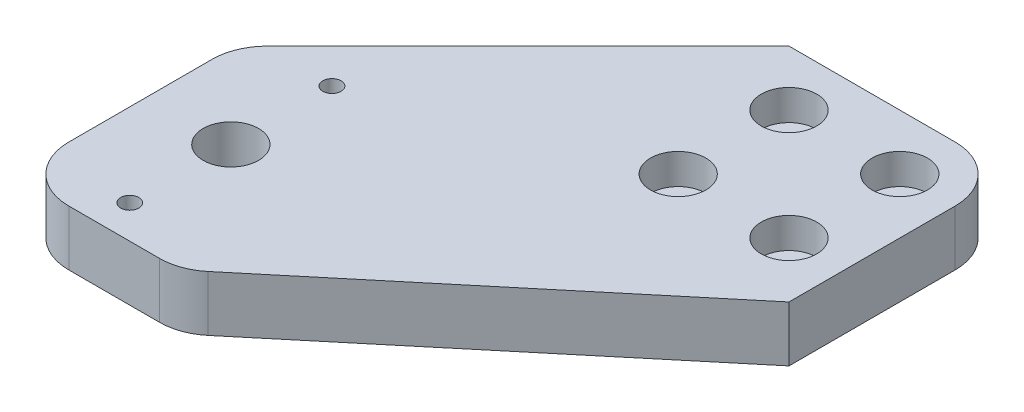
from build123d import *

# Parameters (mm, degrees)
BOSS_EXTRUDE1_DEPTH                                 = 5
CBORE_FOR_M5_HEX_SOCKET_HEAD_CAP_SCREW2_D           = 5.5
CBORE_FOR_M5_HEX_SOCKET_HEAD_CAP_SCREW2_CBORE_D     = 10
CBORE_FOR_M5_HEX_SOCKET_HEAD_CAP_SCREW2_CBORE_DEPTH = 5.5
M4_TAPPED_HOLE1_D                                   = 3.3
SKETCH8_R                                           = 5
CUT_EXTRUDE3_DEPTH                                  = 100.498743711
FILLET1_R                                           = 10


with BuildPart() as part:
    # Sketch1 → Boss-Extrude1 (new, symmetric)
    with BuildSketch(Plane(origin=(0, 0, 0), x_dir=(1, 0, 0), z_dir=(0, 1, 0))):
        Polygon((-20, 20), (20, 20), (20, -20), (-40, -70), (-70, -70), (-70, -30), align=None)
    extrude(amount=BOSS_EXTRUDE1_DEPTH, both=True)

    # CBORE for M5 Hex Socket Head Cap Screw2 (through all)
    with Locations(Plane(origin=(0, 5, 0), x_dir=(1, 0, 0), z_dir=(0, 1, 0))):
        with Locations((-10, 10), (10, 10), (10, -10), (-10, -10)):
            CounterBoreHole(CBORE_FOR_M5_HEX_SOCKET_HEAD_CAP_SCREW2_D / 2, CBORE_FOR_M5_HEX_SOCKET_HEAD_CAP_SCREW2_CBORE_D / 2, CBORE_FOR_M5_HEX_SOCKET_HEAD_CAP_SCREW2_CBORE_DEPTH)

    # M4 Tapped Hole1 (through all)
    with Locations(Plane(origin=(0, 5, 0), x_dir=(1, 0, 0), z_dir=(0, 1, 0))):
        with Locations((-55, -27.5), (-55, -64)):
            Hole(M4_TAPPED_HOLE1_D / 2)

    # Sketch8 → Cut-Extrude3 (cut, through all)
    with BuildSketch(Plane(origin=(0, 5, 0), x_dir=(1, 0, 0), z_dir=(0, 1, 0))):
        with Locations(Location((-55, -45.75, 0), (0, 0, 270))):
            Circle(SKETCH8_R)
    extrude(amount=-CUT_EXTRUDE3_DEPTH, mode=Mode.SUBTRACT)

    # Fillet1
    fillet1_edges = [part.edges().sort_by_distance(p)[0] for p in [
        (20, 0, -20),
        (-40, 0, 70),
        (-70, 0, 70),
        (-70, 0, 30),
    ]]
    fillet(fillet1_edges, radius=FILLET1_R)


solid = part.part
